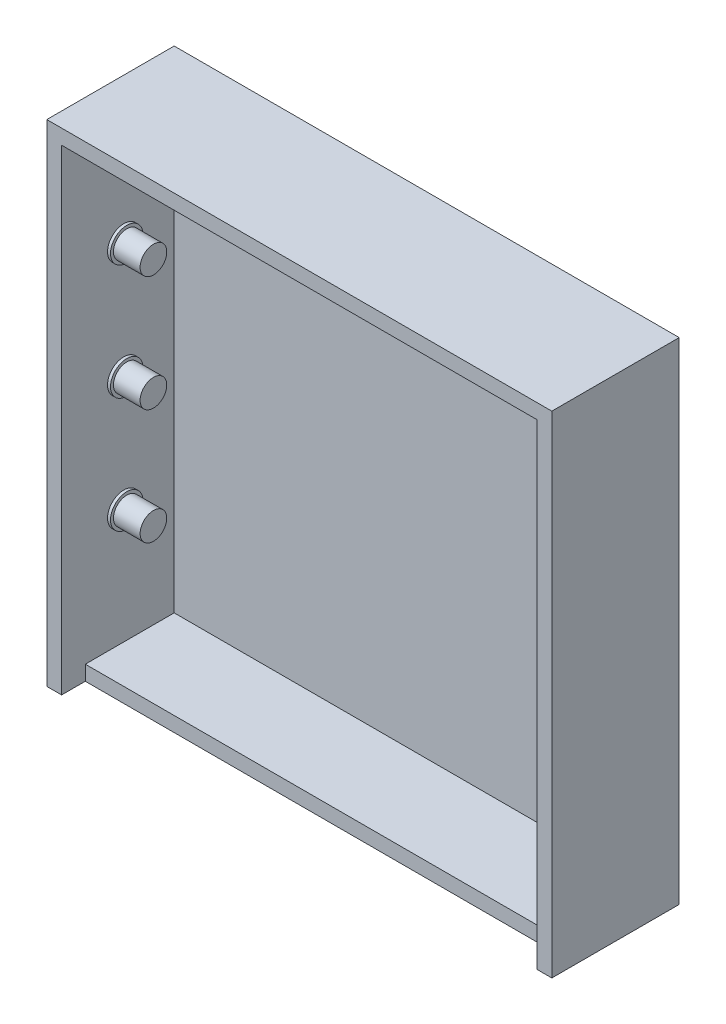
from build123d import *

# Parameters (mm, degrees)
SKETCH1_W               = 170.47
SKETCH1_H               = 165.71
BOSS_EXTRUDE1_DEPTH     = 5
SKETCH2_W               = 170.47
SKETCH2_H               = 165.71
SKETCH2_W_2             = 160.47
SKETCH2_H_2             = 155.71
BOSS_EXTRUDE2_DEPTH     = 38
SKETCH3_W               = 160.47
SKETCH3_H               = 5
CUT_EXTRUDE1_DEPTH      = 8
SKETCH5_R               = 5.5
BOSS_EXTRUDE3_DEPTH     = 1
SKETCH6_R               = 4.5
BOSS_EXTRUDE4_DEPTH     = 9
LPATTERN1_COUNT         = 3
LPATTERN1_PITCH         = 38.9275
MIRROR1_COPY_1_SKETCH_R = 5.5
MIRROR1_COPY_1_DEPTH    = 1
MIRROR1_COPY_2_SKETCH_R = 5.5
MIRROR1_COPY_2_DEPTH    = 1
MIRROR1_COPY_3_SKETCH_R = 4.5
MIRROR1_COPY_3_DEPTH    = 9
MIRROR1_COPY_4_SKETCH_R = 4.5
MIRROR1_COPY_4_DEPTH    = 9


with BuildPart() as part:
    # Sketch1 → Boss-Extrude1 (new body)
    with BuildSketch(Plane.XY):
        with Locations((85.235, 82.855)):
            Rectangle(SKETCH1_W, SKETCH1_H)
    extrude(amount=BOSS_EXTRUDE1_DEPTH)

    # Sketch2 → Boss-Extrude2 (add)
    with BuildSketch(Plane.XY.offset(5)):
        with Locations((85.235, 82.855)):
            Rectangle(SKETCH2_W, SKETCH2_H)
        with Locations((85.235, 82.855)):
            Rectangle(SKETCH2_W_2, SKETCH2_H_2, mode=Mode.SUBTRACT)
    extrude(amount=BOSS_EXTRUDE2_DEPTH)

    # Sketch3 → Cut-Extrude1 (cut)
    with BuildSketch(Plane.XY.offset(43)):
        with Locations((85.235, 2.5)):
            Rectangle(SKETCH3_W, SKETCH3_H)
    extrude(amount=-CUT_EXTRUDE1_DEPTH, mode=Mode.SUBTRACT)

    # Sketch5 → Boss-Extrude3 (add)
    with BuildSketch(Plane.ZY.offset(-165.47)):
        with Locations((22, 121.7825)):
            Circle(SKETCH5_R)
    boss_extrude3 = extrude(amount=BOSS_EXTRUDE3_DEPTH)

    # Sketch6 → Boss-Extrude4 (add)
    with BuildSketch(Plane.ZY.offset(-164.47)):
        with Locations((22, 121.7825)):
            Circle(SKETCH6_R)
    boss_extrude4 = extrude(amount=BOSS_EXTRUDE4_DEPTH)

    # LPattern1: Boss-Extrude3, Boss-Extrude4 ×3
    with Locations(*[(0, -i * LPATTERN1_PITCH, 0) for i in range(1, LPATTERN1_COUNT)]):
        add(boss_extrude3)
        add(boss_extrude4)

    # Mirror1: Boss-Extrude3, Boss-Extrude4 across plane
    add(boss_extrude3.mirror(Plane.ZY.offset(-85.235)))
    add(boss_extrude4.mirror(Plane.ZY.offset(-85.235)))

    # Mirror1 copy 1 sketch → Mirror1 copy 1 (add)
    with BuildSketch(Plane(origin=(5, -38.9275, 0), x_dir=(0, 0, 1), z_dir=(1, 0, 0))):
        with Locations((22, -121.7825)):
            Circle(MIRROR1_COPY_1_SKETCH_R)
    extrude(amount=MIRROR1_COPY_1_DEPTH)

    # Mirror1 copy 2 sketch → Mirror1 copy 2 (add)
    with BuildSketch(Plane(origin=(5, -77.855, 0), x_dir=(0, 0, 1), z_dir=(1, 0, 0))):
        with Locations((22, -121.7825)):
            Circle(MIRROR1_COPY_2_SKETCH_R)
    extrude(amount=MIRROR1_COPY_2_DEPTH)

    # Mirror1 copy 3 sketch → Mirror1 copy 3 (add)
    with BuildSketch(Plane(origin=(6, -38.9275, 0), x_dir=(0, 0, 1), z_dir=(1, 0, 0))):
        with Locations((22, -121.7825)):
            Circle(MIRROR1_COPY_3_SKETCH_R)
    extrude(amount=MIRROR1_COPY_3_DEPTH)

    # Mirror1 copy 4 sketch → Mirror1 copy 4 (add)
    with BuildSketch(Plane(origin=(6, -77.855, 0), x_dir=(0, 0, 1), z_dir=(1, 0, 0))):
        with Locations((22, -121.7825)):
            Circle(MIRROR1_COPY_4_SKETCH_R)
    extrude(amount=MIRROR1_COPY_4_DEPTH)


solid = part.part
